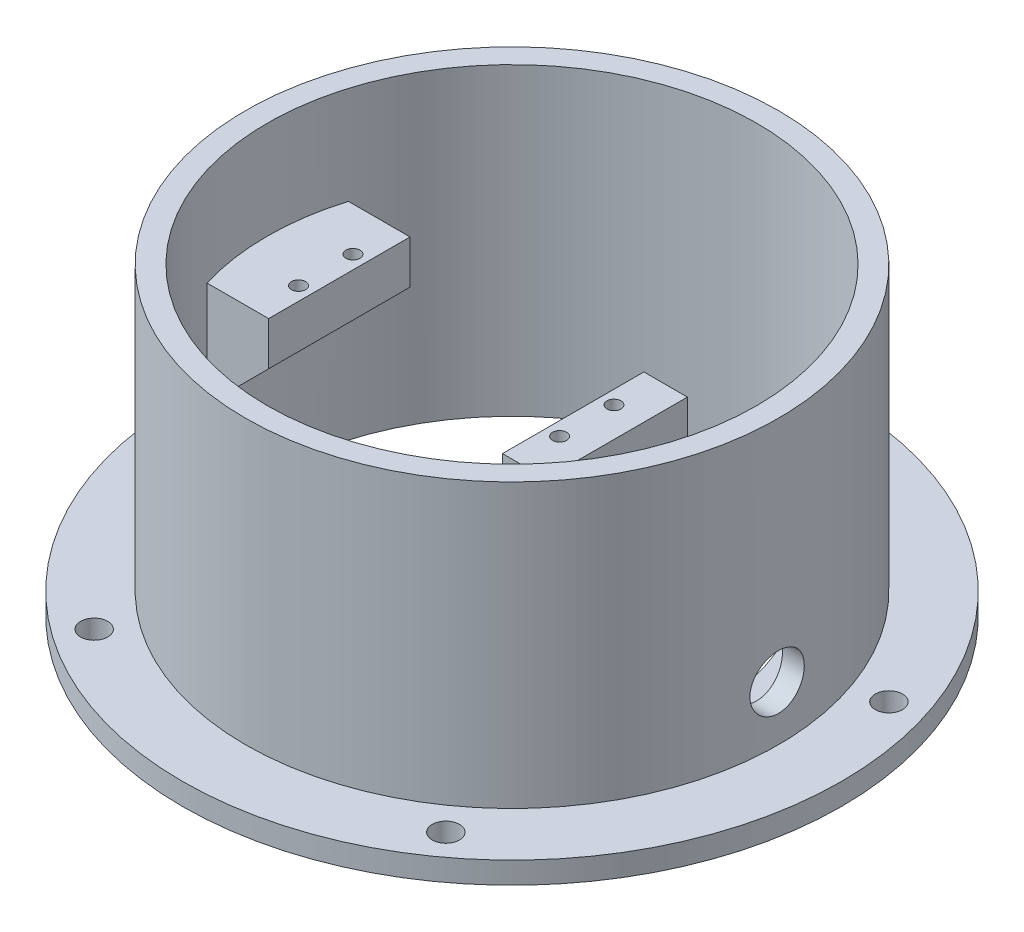
from build123d import *

# Parameters (mm, degrees)
SKETCH1_R               = 60.625
SKETCH1_R_2             = 45
BOSS_EXTRUDE1_DEPTH     = 4
SKETCH2_R               = 49
SKETCH2_R_2             = 45
BOSS_EXTRUDE2_DEPTH     = 52
SKETCH4_W               = 13.25
SKETCH4_H               = 8
SKETCH4_W_2             = 8
SKETCH4_H_2             = 38
BOSS_EXTRUDE4_DEPTH     = 13
BOSS_EXTRUDE5_DEPTH     = 4
SKETCH7_R               = 1.3
CUT_EXTRUDE4_DEPTH      = 7.2
SKETCH9_W               = 10
SKETCH9_H               = 24
CUT_EXTRUDE7_DEPTH      = 8
CUT_EXTRUDE8_REACH      = 139.219
CUT_EXTRUDE8_END_RADIUS = 45
SKETCH11_R              = 5
CUT_EXTRUDE9_DEPTH      = 101.273532203
SKETCH15_R              = 2.5
CUT_EXTRUDE10_DEPTH     = 10


with BuildPart() as part:
    # Sketch1 → Boss-Extrude1 (new body)
    with BuildSketch(Plane(origin=(0, 0, 0), x_dir=(1, 0, 0), z_dir=(0, 1, 0))):
        with Locations(Location((0, 0, 0), (0, 0, 270))):
            Circle(SKETCH1_R)
        with Locations(Location((0, 0, 0), (0, 0, 270))):
            Circle(SKETCH1_R_2, mode=Mode.SUBTRACT)
    extrude(amount=BOSS_EXTRUDE1_DEPTH)

    # Sketch2 → Boss-Extrude2 (add)
    with BuildSketch(Plane(origin=(0, 4, 0), x_dir=(1, 0, 0), z_dir=(0, 1, 0))):
        with Locations(Location((0, 0, 0), (0, 0, 90))):
            Circle(SKETCH2_R)
        with Locations(Location((0, 0, 0), (0, 0, 270))):
            Circle(SKETCH2_R_2, mode=Mode.SUBTRACT)
    extrude(amount=BOSS_EXTRUDE2_DEPTH)

    # Sketch4 → Boss-Extrude4 (add, symmetric)
    with BuildSketch(Plane.XY):
        with Locations((-38.375, 34)):
            Rectangle(SKETCH4_W, SKETCH4_H)
        Polygon((-31.75, 30), (-45, 30), (-45, 16.75), align=None)
        with Locations((15.25, 19)):
            Rectangle(SKETCH4_W_2, SKETCH4_H_2)
    extrude(amount=BOSS_EXTRUDE4_DEPTH, both=True)


with BuildPart() as boss_extrude4_piece_1:
    # of the separate pieces the step leaves, piece 1, a body of its own (boss_extrude4_pieces)
    add(part.part.solids().sort_by_distance((0, 0, 60.625))[0])



with BuildPart() as boss_extrude4_piece_2:
    # of the separate pieces the step leaves, piece 2, a body of its own (boss_extrude4_pieces)
    add(part.part.solids().sort_by_distance((11.25, 38, -13))[0])


with BuildPart() as boss_extrude4_piece_1_1:
    add(boss_extrude4_piece_1.part)

    add(boss_extrude4_piece_2.part)  # Boss-Extrude5 merges Boss-Extrude4 piece 2
    # Sketch5 → Boss-Extrude5 (add)
    with BuildSketch(Plane.XZ):
        with BuildLine():
            Line((11.25, 13), (29.067400866, 34.352382842))
            ThreePointArc((29.067400866, 34.352382842), (45, 0), (29.067400866, -34.352382842))
            Line((29.067400866, -34.352382842), (11.25, -13))
            Line((11.25, -13), (11.25, 13))
        make_face()
    extrude(amount=-BOSS_EXTRUDE5_DEPTH)

    # Sketch7 → Cut-Extrude4 (cut)
    with BuildSketch(Plane(origin=(0, 38, 0), x_dir=(1, 0, 0), z_dir=(0, 1, 0))):
        with Locations(Location((-34.25, 5, 0), (0, 0, 180))):
            Circle(SKETCH7_R)
        with Locations(Location((-34.25, -5, 0), (0, 0, 180))):
            Circle(SKETCH7_R)
        with Locations(Location((13.75, 5, 0), (0, 0, 180))):
            Circle(SKETCH7_R)
        with Locations(Location((13.75, -5, 0), (0, 0, 180))):
            Circle(SKETCH7_R)
    extrude(amount=-CUT_EXTRUDE4_DEPTH, mode=Mode.SUBTRACT)

    # Sketch9 → Cut-Extrude7 (cut)
    with BuildSketch(Plane.ZY.offset(-11.25)):
        with Locations((0, 17)):
            Rectangle(SKETCH9_W, SKETCH9_H)
    extrude(amount=-CUT_EXTRUDE7_DEPTH, mode=Mode.SUBTRACT)

    # Cut-Extrude8: up to this cylinder (the profile starts outside it)
    cut_extrude8_end = Plane(origin=(0, 14, 0), z_dir=(0, -1, 0)) * Cylinder(CUT_EXTRUDE8_END_RADIUS, 369.438, mode=Mode.PRIVATE)
    # Sketch11 → Cut-Extrude8 (cut, up to the surface)
    with BuildSketch(Plane(origin=(49, 0, 0), x_dir=(0, 0, -1), z_dir=(1, 0, 0)), mode=Mode.PRIVATE) as cut_extrude8_sk1:
        with Locations((0, 14)):
            Circle(SKETCH11_R)
    cut_extrude8_tool1 = extrude(cut_extrude8_sk1.sketch, amount=-CUT_EXTRUDE8_REACH, mode=Mode.PRIVATE) - cut_extrude8_end
    add(cut_extrude8_tool1.solids().sort_by_distance((49, 14, 0))[0], mode=Mode.SUBTRACT)

    # Sketch12 → Cut-Extrude9 (cut, through all)
    with BuildSketch(Plane(origin=(0, 4, 0), x_dir=(1, 0, 0), z_dir=(0, 1, 0))):
        with BuildLine():
            Line((29.479537487, 22.359715328), (27.25, 19.687836398))
            Line((27.25, 19.687836398), (27.25, -19.687836398))
            Line((27.25, -19.687836398), (29.479537487, -22.359715328))
            ThreePointArc((29.479537487, -22.359715328), (37, 0), (29.479537487, 22.359715328))
        make_face()
        Polygon((27.25, -19.687836398), (27.25, 19.687836398), (24.25, 16.092634774), (24.25, -16.092634774), align=None)
    extrude(amount=-CUT_EXTRUDE9_DEPTH, mode=Mode.SUBTRACT)

    # Sketch15 → Cut-Extrude10 (cut)
    with BuildSketch(Plane(origin=(0, 4, 0), x_dir=(1, 0, 0), z_dir=(0, 1, 0))):
        with Locations(Location((0, 55, 0), (0, 0, 270))):
            Circle(SKETCH15_R)
        with Locations(Location((52.308108396, 16.995934691, 0), (0, 0, 270))):
            Circle(SKETCH15_R)
        with Locations(Location((32.328188876, -44.495934691, 0), (0, 0, 270))):
            Circle(SKETCH15_R)
        with Locations(Location((-32.328188876, -44.495934691, 0), (0, 0, 270))):
            Circle(SKETCH15_R)
        with Locations(Location((-52.308108396, 16.995934691, 0), (0, 0, 270))):
            Circle(SKETCH15_R)
    extrude(amount=-CUT_EXTRUDE10_DEPTH, mode=Mode.SUBTRACT)


solid = boss_extrude4_piece_1_1.part
